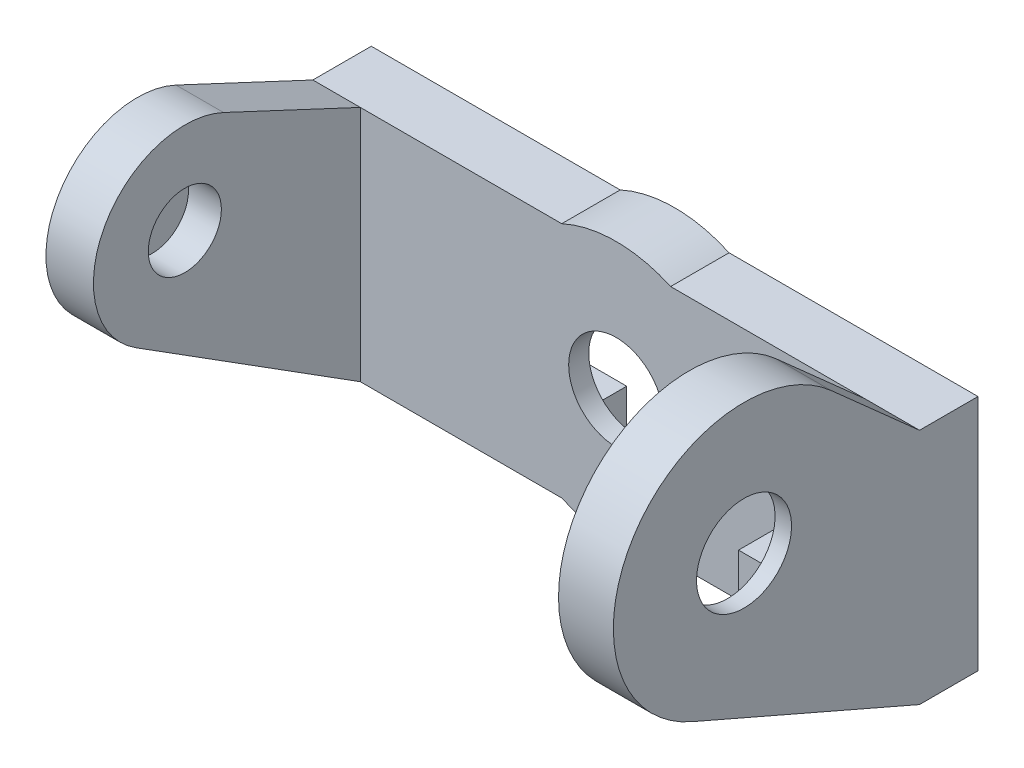
from build123d import *

# Parameters (mm, degrees)
EXTRUDE_1_DEPTH     = 3.2
EXTRUDE_2_DEPTH     = 2.6
EXTRUDE_3_DEPTH     = 3
CUT_EXTRUDE_1_DEPTH = 2.1
SKETCH_5_R          = 2.6
CUT_EXTRUDE_2_DEPTH = 1.1
CUT_EXTRUDE_3_DEPTH = 2.1
SKETCH_7_R          = 2.6
CUT_EXTRUDE_4_DEPTH = 0.9
SKETCH_8_R          = 2
CUT_EXTRUDE_5_DEPTH = 1.8


with BuildPart() as part:
    # ｽｹｯﾁ1 → ﾎﾞｽ - 押し出し1 (new body)
    with BuildSketch(Plane.XY):
        with BuildLine():
            Line((0, 0), (13.621587752, 0))
            ThreePointArc((13.621587752, 0), (16.6, -0.649879964), (19.578412248, 0))
            Line((19.578412248, 0), (33.2, 0))
            Line((33.2, 0), (33.2, 13.000240072))
            Line((33.2, 13.000240072), (19.578412248, 13.000240072))
            ThreePointArc((19.578412248, 13.000240072), (16.6, 13.650120036), (13.621587752, 13.000240072))
            Line((13.621587752, 13.000240072), (0, 13.000240072))
            Line((0, 13.000240072), (0, 0))
        make_face()
    extrude(amount=EXTRUDE_1_DEPTH)

    # ｽｹｯﾁ2 → ﾎﾞｽ - 押し出し2 (add)
    with BuildSketch(Plane.ZY):
        with BuildLine():
            Line((3.199725342, 0), (15.472038891, 7.74466563))
            ThreePointArc((15.472038891, 7.74466563), (17.190896421, 14.371374104), (10.684882054, 16.501987504))
            Line((10.684882054, 16.501987504), (3.199725342, 13.000240072))
            Line((3.199725342, 13.000240072), (3.199725342, 0))
        make_face()
    extrude(amount=-EXTRUDE_2_DEPTH)

    # ｽｹｯﾁ3 → ﾎﾞｽ - 押し出し3 (add)
    with BuildSketch(Plane(origin=(33.2, 0, 0), x_dir=(0, 0, -1), z_dir=(1, 0, 0))):
        with BuildLine():
            Line((-3.199725342, 13.000240072), (-8.051923005, 17.315733546))
            ThreePointArc((-8.051923005, 17.315733546), (-18.828777882, 15.822754082), (-15.654913036, 5.416209475))
            Line((-15.654913036, 5.416209475), (-3.199725342, 0))
            Line((-3.199725342, 0), (-3.199725342, 13.000240072))
        make_face()
    extrude(amount=-EXTRUDE_3_DEPTH)

    # ｽｹｯﾁ4 → ｶｯﾄ - 押し出し1 (cut)
    with BuildSketch(Plane(origin=(0, 0, 0), x_dir=(-1, 0, 0), z_dir=(0, 0, -1))):
        with BuildLine():
            Line((-19.223176421, 11.277459888), (-19.223176421, 9.123296456))
            Line((-19.223176421, 9.123296456), (-21.377339853, 9.123296456))
            ThreePointArc((-21.377339853, 9.123296456), (-22.05014042, 6.500120036), (-21.377339853, 3.876943615))
            Line((-21.377339853, 3.876943615), (-19.223176421, 3.876943615))
            Line((-19.223176421, 3.876943615), (-19.223176421, 1.722780183))
            ThreePointArc((-19.223176421, 1.722780183), (-16.6, 1.049979616), (-13.976823579, 1.722780183))
            Line((-13.976823579, 1.722780183), (-13.976823579, 3.876943615))
            Line((-13.976823579, 3.876943615), (-11.822660147, 3.876943615))
            ThreePointArc((-11.822660147, 3.876943615), (-11.14985958, 6.500120036), (-11.822660147, 9.123296456))
            Line((-11.822660147, 9.123296456), (-13.976823579, 9.123296456))
            Line((-13.976823579, 9.123296456), (-13.976823579, 11.277459888))
            ThreePointArc((-13.976823579, 11.277459888), (-16.6, 11.950260456), (-19.223176421, 11.277459888))
        make_face()
    extrude(amount=-CUT_EXTRUDE_1_DEPTH, mode=Mode.SUBTRACT)

    # ｽｹｯﾁ5 → ｶｯﾄ - 押し出し2 (cut)
    with BuildSketch(Plane(origin=(0, 0, 2.1), x_dir=(-1, 0, 0), z_dir=(0, 0, -1))):
        with Locations((-16.6, 6.500120036)):
            Circle(SKETCH_5_R)
    extrude(amount=-CUT_EXTRUDE_2_DEPTH, mode=Mode.SUBTRACT)

    # ｽｹｯﾁ6 → ｶｯﾄ - 押し出し3 (cut)
    with BuildSketch(Plane.ZY.offset(-30.2)):
        with BuildLine():
            Line((15.503618238, 7.124116138), (15.503618238, 9.2730851))
            Line((15.503618238, 9.2730851), (17.6525872, 9.2730851))
            ThreePointArc((17.6525872, 9.2730851), (18.353618238, 11.9730851), (17.6525872, 14.6730851))
            Line((17.6525872, 14.6730851), (15.503618238, 14.6730851))
            Line((15.503618238, 14.6730851), (15.503618238, 16.822054063))
            ThreePointArc((15.503618238, 16.822054063), (12.803618238, 17.5230851), (10.103618238, 16.822054063))
            Line((10.103618238, 16.822054063), (10.103618238, 14.6730851))
            Line((10.103618238, 14.6730851), (7.954649275, 14.6730851))
            ThreePointArc((7.954649275, 14.6730851), (7.253618238, 11.9730851), (7.954649275, 9.2730851))
            Line((7.954649275, 9.2730851), (10.103618238, 9.2730851))
            Line((10.103618238, 9.2730851), (10.103618238, 7.124116138))
            ThreePointArc((10.103618238, 7.124116138), (12.803618238, 6.4230851), (15.503618238, 7.124116138))
        make_face()
    extrude(amount=-CUT_EXTRUDE_3_DEPTH, mode=Mode.SUBTRACT)

    # ｽｹｯﾁ7 → ｶｯﾄ - 押し出し4 (cut)
    with BuildSketch(Plane.ZY.offset(-32.3)):
        with Locations((12.803618238, 11.9730851)):
            Circle(SKETCH_7_R)
    extrude(amount=-CUT_EXTRUDE_4_DEPTH, mode=Mode.SUBTRACT)

    # ｽｹｯﾁ8 → ｶｯﾄ - 押し出し5 (cut)
    with BuildSketch(Plane(origin=(2.6, 0, 0), x_dir=(0, 0, -1), z_dir=(1, 0, 0))):
        with Locations((-12.803618238, 11.9730851)):
            Circle(SKETCH_8_R)
    extrude(amount=-CUT_EXTRUDE_5_DEPTH, mode=Mode.SUBTRACT)


solid = part.part
